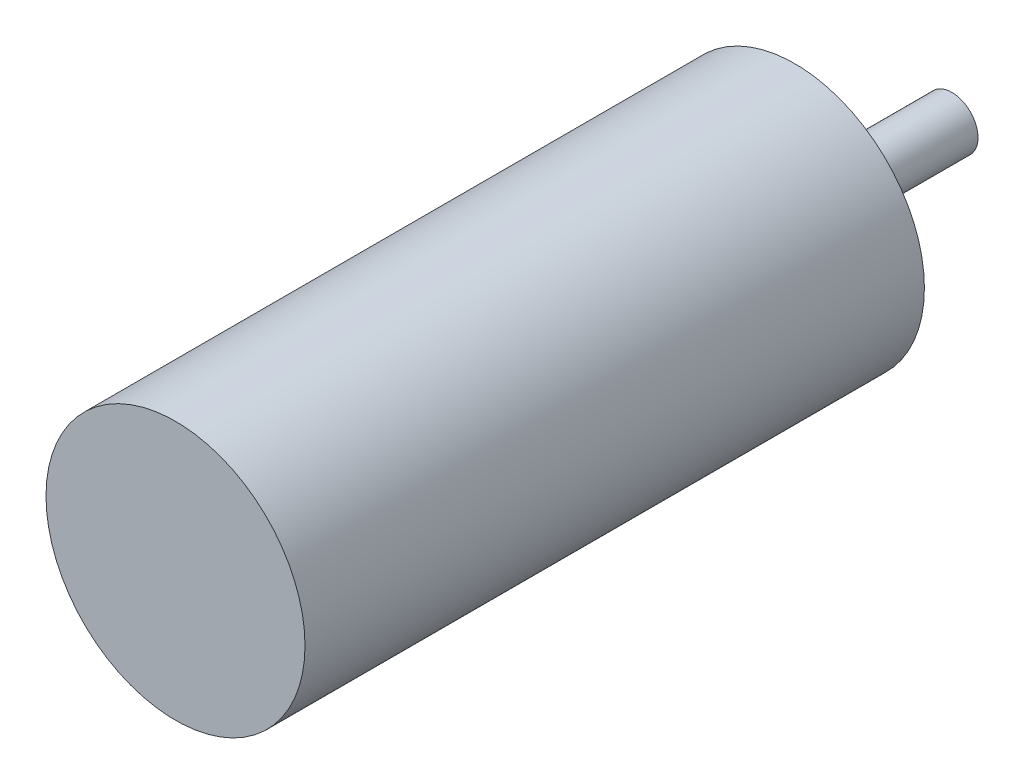
from build123d import *

# Parameters (mm, degrees)
SKETCH2_R           = 19.8
BOSS_EXTRUDE1_DEPTH = 94.7
SKETCH3_R           = 4
BOSS_EXTRUDE2_DEPTH = 24


with BuildPart() as part:
    # Sketch2 → Boss-Extrude1 (new body)
    with BuildSketch(Plane.XY):
        Circle(SKETCH2_R)
    extrude(amount=-BOSS_EXTRUDE1_DEPTH)

    # Sketch3 → Boss-Extrude2 (add)
    with BuildSketch(Plane(origin=(0, 0, -94.7), x_dir=(-1, 0, 0), z_dir=(0, 0, -1))):
        Circle(SKETCH3_R)
    extrude(amount=BOSS_EXTRUDE2_DEPTH)


solid = part.part
